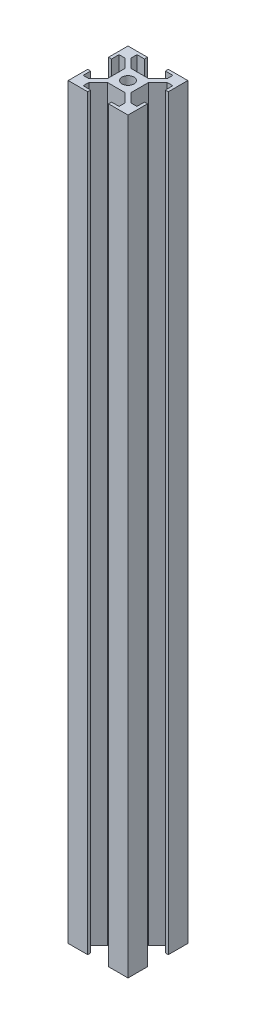
from build123d import *

# Parameters (mm, degrees)
SKETCH1_W               = 40
SKETCH1_H               = 40
BOSS_EXTRUDE1_DEPTH     = 500
CUT_EXTRUDE1_DEPTH      = 501.799361022
CUT_EXTRUDE1_DEPTH_BACK = 501.799361022
SKETCH2_R               = 4


with BuildPart() as part:
    # Sketch1 → Boss-Extrude1 (new body)
    with BuildSketch(Plane(origin=(0, 0, 0), x_dir=(1, 0, 0), z_dir=(0, 1, 0))):
        Rectangle(SKETCH1_W, SKETCH1_H)
    extrude(amount=BOSS_EXTRUDE1_DEPTH)

    # Sketch2 → Cut-Extrude1 (cut, two sides: drawn at the far end of the back side and taken through both)
    with BuildSketch(Plane(origin=(0, 500, 0), x_dir=(1, 0, 0), z_dir=(0, 1, 0)).offset(-CUT_EXTRUDE1_DEPTH_BACK)):
        with Locations(Location((0, 0, 0), (0, 0, 270))):
            Circle(SKETCH2_R)
        Polygon((-7, 20), (-7, 18), (-12, 18), (-12, 14.121320344), (-5.878679656, 8), (5.878679656, 8), (12, 14.121320344), (12, 18), (7, 18), (7, 20), align=None)
        Polygon((20, 7), (18, 7), (18, 12), (14.121320344, 12), (8, 5.878679656), (8, -5.878679656), (14.121320344, -12), (18, -12), (18, -7), (20, -7), align=None)
        Polygon((7, -20), (7, -18), (12, -18), (12, -14.121320344), (5.878679656, -8), (-5.878679656, -8), (-12, -14.121320344), (-12, -18), (-7, -18), (-7, -20), align=None)
        Polygon((-20, -7), (-18, -7), (-18, -12), (-14.121320344, -12), (-8, -5.878679656), (-8, 5.878679656), (-14.121320344, 12), (-18, 12), (-18, 7), (-20, 7), align=None)
    extrude(amount=CUT_EXTRUDE1_DEPTH + CUT_EXTRUDE1_DEPTH_BACK, mode=Mode.SUBTRACT)


solid = part.part
